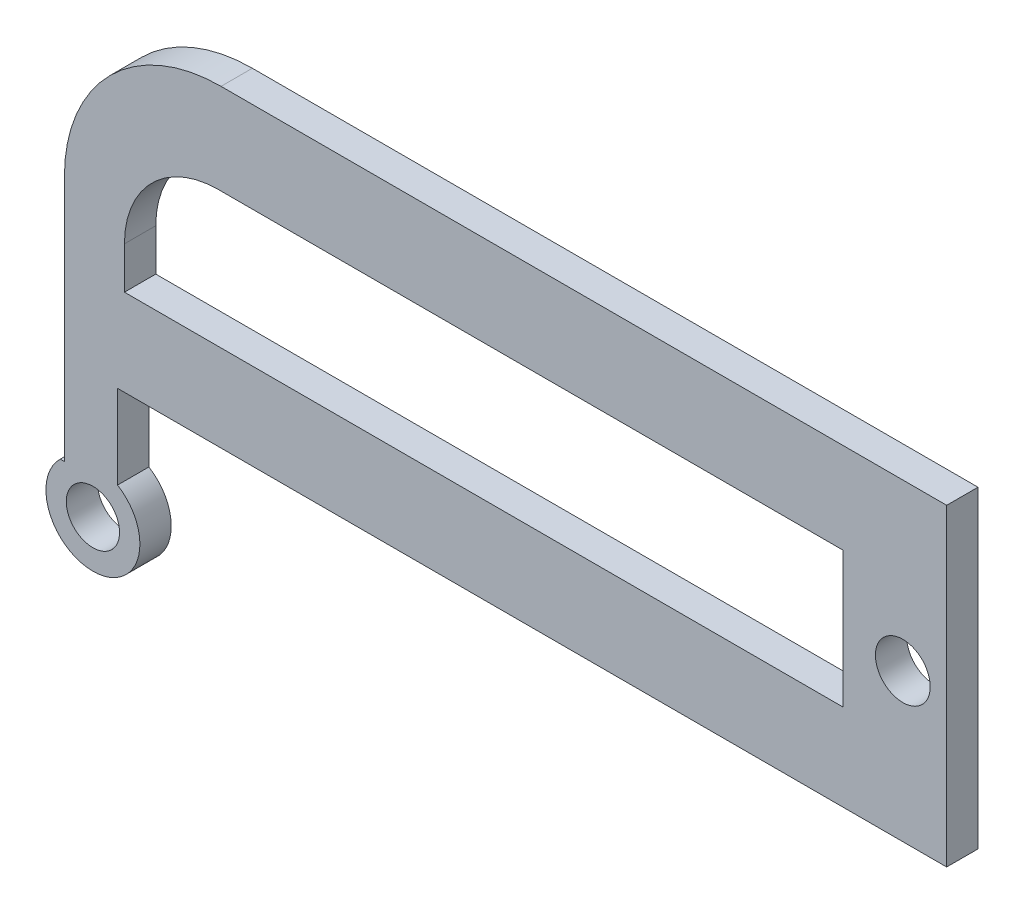
from build123d import *

# Parameters (mm, degrees)
SKETCH1_R           = 1.7
SKETCH1_R_2         = 1.75
BOSS_EXTRUDE2_DEPTH = 2
FILLET1_R           = 10
CUT_EXTRUDE1_DEPTH  = 4.3


with BuildPart() as part:
    # Sketch1 → Boss-Extrude2 (new body)
    with BuildSketch(Plane.XY):
        with BuildLine():
            Line((-24.301399152, -6.742575532), (21.488241451, -6.742575532))
            Line((21.488241451, -6.742575532), (28.630568437, -6.742575532))
            Line((28.630568437, -6.742575532), (28.630568437, 13.257424468))
            Line((28.630568437, 13.257424468), (21.488241451, 13.257424468))
            Line((21.488241451, 13.257424468), (-17.840083641, 13.257424468))
            Line((-17.840083641, 13.257424468), (-21.005321996, 13.257424468))
            Line((-21.005321996, 13.257424468), (-27.697276817, 13.257424468))
            Line((-27.697276817, 13.257424468), (-27.697276817, -12.486730567))
            Line((-27.697276817, -12.486730567), (-27.960658237, -12.486730567))
            ThreePointArc((-27.960658237, -12.486730567), (-25.553021513, -17.62663418), (-24.301399152, -12.090501486))
            Line((-24.301399152, -12.090501486), (-24.301399152, -8.994116068))
            Line((-24.301399152, -8.994116068), (-24.301399152, -6.742575532))
        make_face()
        with Locations((-25.875977425, -14.644068258)):
            Circle(SKETCH1_R, mode=Mode.SUBTRACT)
        with Locations((25.830760295, 2.700271972)):
            Circle(SKETCH1_R_2, mode=Mode.SUBTRACT)
    extrude(amount=BOSS_EXTRUDE2_DEPTH)

    # Fillet1
    fillet1_edges = [part.edges().sort_by_distance(p)[0] for p in [
        (-27.697276817, 13.257424468, 1),
    ]]
    fillet(fillet1_edges, radius=FILLET1_R)

    # Sketch2 → Cut-Extrude1 (cut)
    with BuildSketch(Plane.XY.offset(2)):
        with BuildLine():
            Line((-23.863033574, -1.206587224), (22.005338697, -1.206587224))
            Line((22.005338697, -1.206587224), (22.005338697, 7.467544216))
            Line((22.005338697, 7.467544216), (-17.863033574, 7.467544216))
            ThreePointArc((-17.863033574, 7.467544216), (-22.105674261, 5.710184903), (-23.863033574, 1.467544216))
            Line((-23.863033574, 1.467544216), (-23.863033574, -1.206587224))
        make_face()
    extrude(amount=-CUT_EXTRUDE1_DEPTH, mode=Mode.SUBTRACT)


solid = part.part
